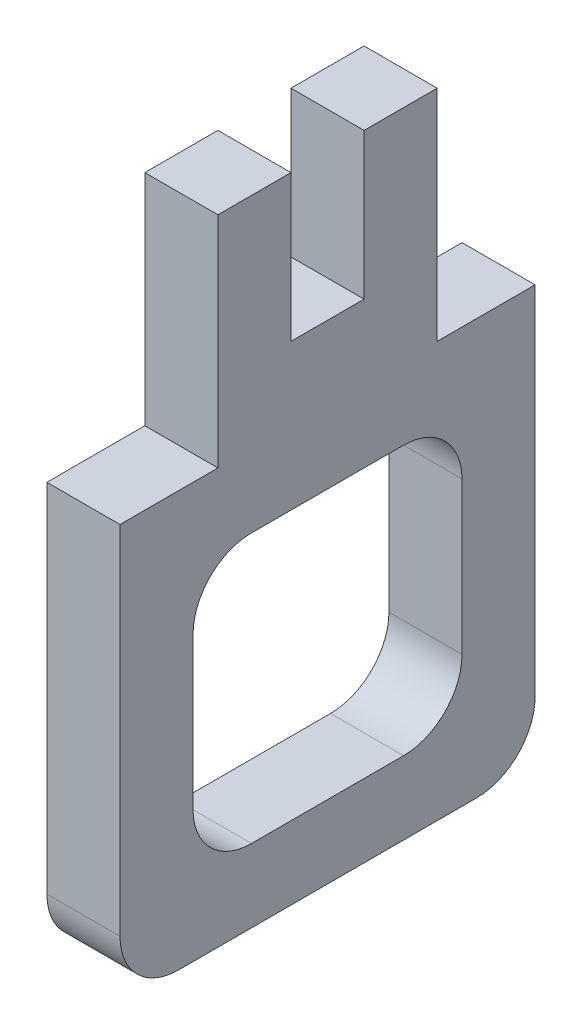
from build123d import *

# Parameters (mm, degrees)
BOSS_EXTRUDE1_DEPTH = 6.35


with BuildPart() as part:
    # Sketch2 → Boss-Extrude1 (new body)
    with BuildSketch(Plane(origin=(0, 0, 0), x_dir=(0, 0, -1), z_dir=(1, 0, 0))):
        with BuildLine():
            Line((14.859, 55.118), (14.859, 42.418))
            Line((14.859, 42.418), (21.209, 42.418))
            Line((21.209, 42.418), (21.209, 55.118))
            Line((21.209, 55.118), (27.559, 55.118))
            Line((27.559, 55.118), (27.559, 36.068))
            Line((27.559, 36.068), (36.068, 36.068))
            Line((36.068, 36.068), (36.068, 5.08))
            ThreePointArc((36.068, 5.08), (34.580102448, 1.487897552), (30.988, 0))
            Line((30.988, 0), (5.08, 0))
            ThreePointArc((5.08, 0), (1.487897552, 1.487897552), (0, 5.08))
            Line((0, 5.08), (0, 36.068))
            Line((0, 36.068), (8.509, 36.068))
            Line((8.509, 36.068), (8.509, 55.118))
            Line((8.509, 55.118), (14.859, 55.118))
        make_face()
        with BuildLine():
            Line((11.43, 6.35), (24.638, 6.35))
            ThreePointArc((24.638, 6.35), (28.230102448, 7.837897552), (29.718, 11.43))
            Line((29.718, 11.43), (29.718, 24.638))
            ThreePointArc((29.718, 24.638), (28.230102448, 28.230102448), (24.638, 29.718))
            Line((24.638, 29.718), (11.43, 29.718))
            ThreePointArc((11.43, 29.718), (7.837897552, 28.230102448), (6.35, 24.638))
            Line((6.35, 24.638), (6.35, 11.43))
            ThreePointArc((6.35, 11.43), (7.837897552, 7.837897552), (11.43, 6.35))
        make_face(mode=Mode.SUBTRACT)
    extrude(amount=BOSS_EXTRUDE1_DEPTH)


solid = part.part
